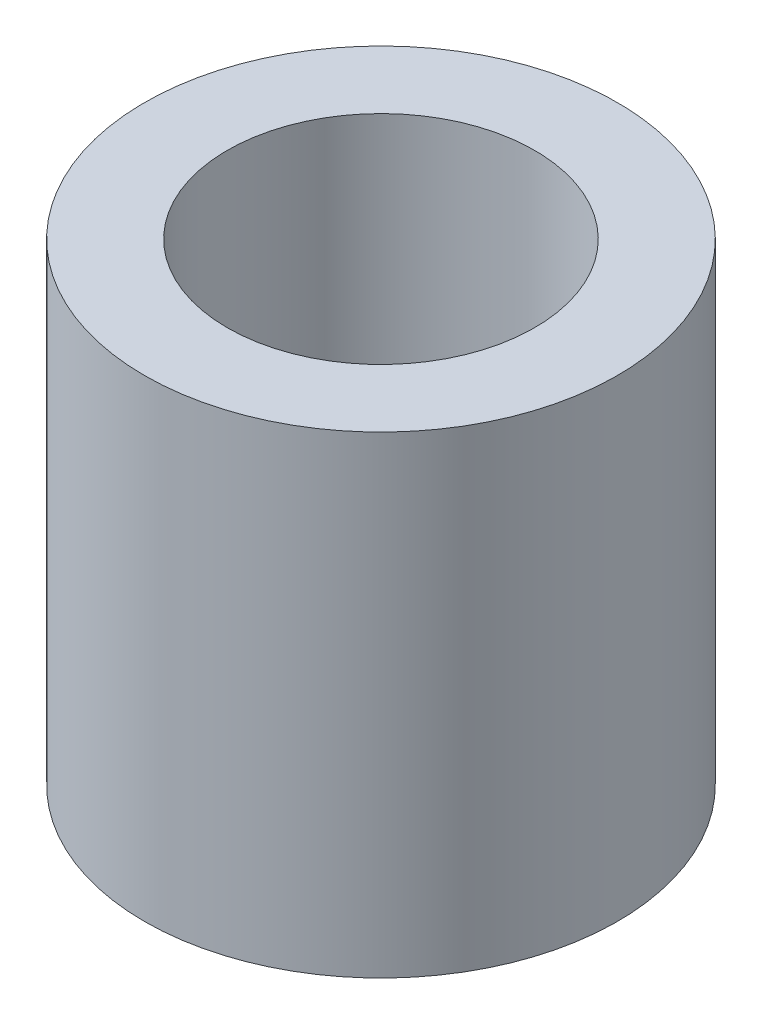
from build123d import *

# Parameters (mm, degrees)
SKETCH_1_R      = 5
SKETCH_1_R_2    = 3.25
EXTRUDE_1_DEPTH = 10


with BuildPart() as part:
    # 草图1 → 凸台-拉伸1 (new body)
    with BuildSketch(Plane(origin=(0, 0, 0), x_dir=(1, 0, 0), z_dir=(0, 1, 0))):
        with Locations(Location((0, 0, 0), (0, 0, 270))):
            Circle(SKETCH_1_R)
        with Locations(Location((0, 0, 0), (0, 0, 270))):
            Circle(SKETCH_1_R_2, mode=Mode.SUBTRACT)
    extrude(amount=EXTRUDE_1_DEPTH)


solid = part.part
